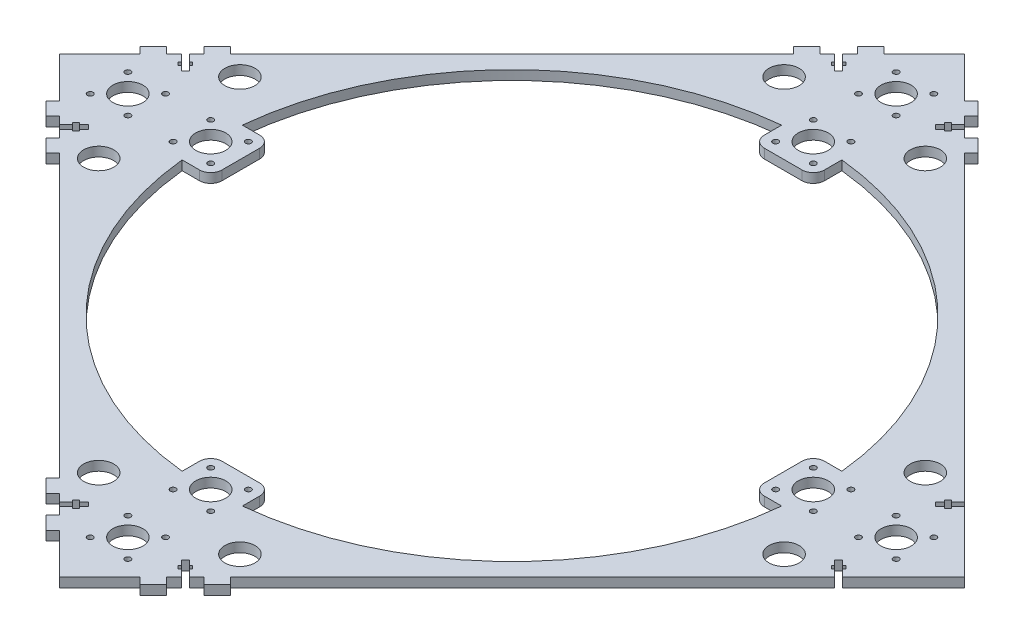
from build123d import *

# Parameters (mm, degrees)
SKETCH1_TOP_SKETCH_7_R   = 1.5
SKETCH1_TOP_SKETCH_7_R_2 = 8
BOSS_EXTRUDE2_DEPTH      = 5


with BuildPart() as part:
    # Sketch1-Top Sketch<7> → Boss-Extrude2 (new body)
    with BuildSketch(Plane(origin=(0, 0, 0), x_dir=(1, 0, 0), z_dir=(0, 1, 0))):
        Polygon((32.022907321, 215.464466094), (24.951839509, 222.535533906), (21.416305603, 219), (0, 240.416305603), (-21.416305603, 219), (-24.951839509, 222.535533906), (-32.022907321, 215.464466094), (-28.487373415, 211.928932188), (-32.39749263, 208.018812973), (-28.861958724, 204.483279068), (-27.978075248, 205.367162544), (-26.210308295, 203.599395591), (-27.094191771, 202.715512115), (-24.619318037, 200.24063838), (-26.74063838, 198.119318037), (-29.215512115, 200.594191771), (-30.099395591, 199.710308295), (-31.867162544, 201.478075248), (-30.983279068, 202.361958724), (-34.518812973, 205.89749263), (-38.428932188, 201.987373415), (-41.964466094, 205.522907321), (-49.035533906, 198.451839509), (-45.5, 194.916305603), (-194.916305603, 45.5), (-198.451839509, 49.035533906), (-205.522907321, 41.964466094), (-201.987373415, 38.428932188), (-205.89749263, 34.518812973), (-202.361958724, 30.983279068), (-201.478075248, 31.867162544), (-199.710308295, 30.099395591), (-200.594191771, 29.215512115), (-198.119318037, 26.74063838), (-200.24063838, 24.619318037), (-202.715512115, 27.094191771), (-203.599395591, 26.210308295), (-205.367162544, 27.978075248), (-204.483279068, 28.861958724), (-208.018812973, 32.39749263), (-211.928932188, 28.487373415), (-215.464466094, 32.022907321), (-222.535533906, 24.951839509), (-219, 21.416305603), (-240.416305603, 0), (-219, -21.416305603), (-222.535533906, -24.951839509), (-215.464466094, -32.022907321), (-211.928932188, -28.487373415), (-208.018812973, -32.39749263), (-204.483279068, -28.861958724), (-205.367162544, -27.978075248), (-203.599395591, -26.210308295), (-202.715512115, -27.094191771), (-200.24063838, -24.619318037), (-198.119318037, -26.74063838), (-200.594191771, -29.215512115), (-199.710308295, -30.099395591), (-201.478075248, -31.867162544), (-202.361958724, -30.983279068), (-205.89749263, -34.518812973), (-201.987373415, -38.428932188), (-205.522907321, -41.964466094), (-198.451839509, -49.035533906), (-194.916305603, -45.5), (-45.5, -194.916305603), (-49.035533906, -198.451839509), (-41.964466094, -205.522907321), (-38.428932188, -201.987373415), (-34.518812973, -205.89749263), (-30.983279068, -202.361958724), (-31.867162544, -201.478075248), (-30.099395591, -199.710308295), (-29.215512115, -200.594191771), (-26.74063838, -198.119318037), (-24.619318037, -200.24063838), (-27.094191771, -202.715512115), (-26.210308295, -203.599395591), (-27.978075248, -205.367162544), (-28.861958724, -204.483279068), (-32.39749263, -208.018812973), (-28.487373415, -211.928932188), (-32.022907321, -215.464466094), (-24.951839509, -222.535533906), (-21.416305603, -219), (0, -240.416305603), (21.416305603, -219), (24.951839509, -222.535533906), (32.022907321, -215.464466094), (28.487373415, -211.928932188), (32.39749263, -208.018812973), (28.861958724, -204.483279068), (27.978075248, -205.367162544), (26.210308295, -203.599395591), (27.094191771, -202.715512115), (24.619318037, -200.24063838), (26.74063838, -198.119318037), (29.215512115, -200.594191771), (30.099395591, -199.710308295), (31.867162544, -201.478075248), (30.983279068, -202.361958724), (34.518812973, -205.89749263), (38.428932188, -201.987373415), (41.964466094, -205.522907321), (49.035533906, -198.451839509), (45.5, -194.916305603), (205.89749263, -34.518812973), (202.361958724, -30.983279068), (201.478075248, -31.867162544), (199.710308295, -30.099395591), (200.594191771, -29.215512115), (198.119318037, -26.74063838), (200.24063838, -24.619318037), (202.715512115, -27.094191771), (203.599395591, -26.210308295), (205.367162544, -27.978075248), (204.483279068, -28.861958724), (208.018812973, -32.39749263), (240.416305603, 0), (208.018812973, 32.39749263), (204.483279068, 28.861958724), (205.367162544, 27.978075248), (203.599395591, 26.210308295), (202.715512115, 27.094191771), (200.24063838, 24.619318037), (198.119318037, 26.74063838), (200.594191771, 29.215512115), (199.710308295, 30.099395591), (201.478075248, 31.867162544), (202.361958724, 30.983279068), (205.89749263, 34.518812973), (45.5, 194.916305603), (49.035533906, 198.451839509), (41.964466094, 205.522907321), (38.428932188, 201.987373415), (34.518812973, 205.89749263), (30.983279068, 202.361958724), (31.867162544, 201.478075248), (30.099395591, 199.710308295), (29.215512115, 200.594191771), (26.74063838, 198.119318037), (24.619318037, 200.24063838), (27.094191771, 202.715512115), (26.210308295, 203.599395591), (27.978075248, 205.367162544), (28.861958724, 204.483279068), (32.39749263, 208.018812973), (28.487373415, 211.928932188), align=None)
        with Locations((10, 214)):
            Circle(SKETCH1_TOP_SKETCH_7_R, mode=Mode.SUBTRACT)
        with Locations((182, 37.5)):
            Circle(SKETCH1_TOP_SKETCH_7_R_2, mode=Mode.SUBTRACT)
        with BuildLine():
            ThreePointArc((16, 159.197989937), (113.13708499, 113.13708499), (159.197989937, 16))
            Line((159.197989937, 16), (150, 16))
            ThreePointArc((150, 16), (145.757359313, 14.242640687), (144, 10))
            Line((144, 10), (144, -10))
            ThreePointArc((144, -10), (145.757359313, -14.242640687), (150, -16))
            Line((150, -16), (159.197989937, -16))
            ThreePointArc((159.197989937, -16), (113.13708499, -113.13708499), (16, -159.197989937))
            Line((16, -159.197989937), (16, -150))
            ThreePointArc((16, -150), (14.242640687, -145.757359313), (10, -144))
            Line((10, -144), (-10, -144))
            ThreePointArc((-10, -144), (-14.242640687, -145.757359313), (-16, -150))
            Line((-16, -150), (-16, -159.197989937))
            ThreePointArc((-16, -159.197989937), (-113.13708499, -113.13708499), (-159.197989937, -16))
            Line((-159.197989937, -16), (-150, -16))
            ThreePointArc((-150, -16), (-145.757359313, -14.242640687), (-144, -10))
            Line((-144, -10), (-144, 10))
            ThreePointArc((-144, 10), (-145.757359313, 14.242640687), (-150, 16))
            Line((-150, 16), (-159.197989937, 16))
            ThreePointArc((-159.197989937, 16), (-113.13708499, 113.13708499), (-16, 159.197989937))
            Line((-16, 159.197989937), (-16, 150))
            ThreePointArc((-16, 150), (-14.242640687, 145.757359313), (-10, 144))
            Line((-10, 144), (10, 144))
            ThreePointArc((10, 144), (14.242640687, 145.757359313), (16, 150))
            Line((16, 150), (16, 159.197989937))
        make_face(mode=Mode.SUBTRACT)
        with Locations((182, -37.5)):
            Circle(SKETCH1_TOP_SKETCH_7_R_2, mode=Mode.SUBTRACT)
        with Locations((-10, -214)):
            Circle(SKETCH1_TOP_SKETCH_7_R, mode=Mode.SUBTRACT)
        with Locations((-10, -194)):
            Circle(SKETCH1_TOP_SKETCH_7_R, mode=Mode.SUBTRACT)
        with Locations((-37.5, -182)):
            Circle(SKETCH1_TOP_SKETCH_7_R_2, mode=Mode.SUBTRACT)
        with Locations((-10, -170)):
            Circle(SKETCH1_TOP_SKETCH_7_R, mode=Mode.SUBTRACT)
        with Locations((0, -160)):
            Circle(SKETCH1_TOP_SKETCH_7_R_2, mode=Mode.SUBTRACT)
        with Locations((-10, -150)):
            Circle(SKETCH1_TOP_SKETCH_7_R, mode=Mode.SUBTRACT)
        with Locations((-214, -10)):
            Circle(SKETCH1_TOP_SKETCH_7_R, mode=Mode.SUBTRACT)
        with Locations((-194, -10)):
            Circle(SKETCH1_TOP_SKETCH_7_R, mode=Mode.SUBTRACT)
        with Locations((-182, -37.5)):
            Circle(SKETCH1_TOP_SKETCH_7_R_2, mode=Mode.SUBTRACT)
        with Locations((-170, -10)):
            Circle(SKETCH1_TOP_SKETCH_7_R, mode=Mode.SUBTRACT)
        with Locations((-150, -10)):
            Circle(SKETCH1_TOP_SKETCH_7_R, mode=Mode.SUBTRACT)
        with Locations((10, -214)):
            Circle(SKETCH1_TOP_SKETCH_7_R, mode=Mode.SUBTRACT)
        with Locations((0, -204)):
            Circle(SKETCH1_TOP_SKETCH_7_R_2, mode=Mode.SUBTRACT)
        with Locations((10, -194)):
            Circle(SKETCH1_TOP_SKETCH_7_R, mode=Mode.SUBTRACT)
        with Locations((10, -170)):
            Circle(SKETCH1_TOP_SKETCH_7_R, mode=Mode.SUBTRACT)
        with Locations((37.5, -182)):
            Circle(SKETCH1_TOP_SKETCH_7_R_2, mode=Mode.SUBTRACT)
        with Locations((10, -150)):
            Circle(SKETCH1_TOP_SKETCH_7_R, mode=Mode.SUBTRACT)
        with Locations((-204, 0)):
            Circle(SKETCH1_TOP_SKETCH_7_R_2, mode=Mode.SUBTRACT)
        with Locations((-214, 10)):
            Circle(SKETCH1_TOP_SKETCH_7_R, mode=Mode.SUBTRACT)
        with Locations((-194, 10)):
            Circle(SKETCH1_TOP_SKETCH_7_R, mode=Mode.SUBTRACT)
        with Locations((-160, 0)):
            Circle(SKETCH1_TOP_SKETCH_7_R_2, mode=Mode.SUBTRACT)
        with Locations((-170, 10)):
            Circle(SKETCH1_TOP_SKETCH_7_R, mode=Mode.SUBTRACT)
        with Locations((-150, 10)):
            Circle(SKETCH1_TOP_SKETCH_7_R, mode=Mode.SUBTRACT)
        with Locations((-182, 37.5)):
            Circle(SKETCH1_TOP_SKETCH_7_R_2, mode=Mode.SUBTRACT)
        with Locations((-10, 150)):
            Circle(SKETCH1_TOP_SKETCH_7_R, mode=Mode.SUBTRACT)
        with Locations((-37.5, 182)):
            Circle(SKETCH1_TOP_SKETCH_7_R_2, mode=Mode.SUBTRACT)
        with Locations((-10, 170)):
            Circle(SKETCH1_TOP_SKETCH_7_R, mode=Mode.SUBTRACT)
        with Locations((-10, 194)):
            Circle(SKETCH1_TOP_SKETCH_7_R, mode=Mode.SUBTRACT)
        with Locations((-10, 214)):
            Circle(SKETCH1_TOP_SKETCH_7_R, mode=Mode.SUBTRACT)
        with Locations((10, 150)):
            Circle(SKETCH1_TOP_SKETCH_7_R, mode=Mode.SUBTRACT)
        with Locations((0, 160)):
            Circle(SKETCH1_TOP_SKETCH_7_R_2, mode=Mode.SUBTRACT)
        with Locations((10, 170)):
            Circle(SKETCH1_TOP_SKETCH_7_R, mode=Mode.SUBTRACT)
        with Locations((37.5, 182)):
            Circle(SKETCH1_TOP_SKETCH_7_R_2, mode=Mode.SUBTRACT)
        with Locations((10, 194)):
            Circle(SKETCH1_TOP_SKETCH_7_R, mode=Mode.SUBTRACT)
        with Locations((0, 204)):
            Circle(SKETCH1_TOP_SKETCH_7_R_2, mode=Mode.SUBTRACT)
        with Locations((214, 10)):
            Circle(SKETCH1_TOP_SKETCH_7_R, mode=Mode.SUBTRACT)
        with Locations((170, -10)):
            Circle(SKETCH1_TOP_SKETCH_7_R, mode=Mode.SUBTRACT)
        with Locations((194, -10)):
            Circle(SKETCH1_TOP_SKETCH_7_R, mode=Mode.SUBTRACT)
        with Locations((214, -10)):
            Circle(SKETCH1_TOP_SKETCH_7_R, mode=Mode.SUBTRACT)
        with Locations((170, 10)):
            Circle(SKETCH1_TOP_SKETCH_7_R, mode=Mode.SUBTRACT)
        with Locations((194, 10)):
            Circle(SKETCH1_TOP_SKETCH_7_R, mode=Mode.SUBTRACT)
        with Locations((150, -10)):
            Circle(SKETCH1_TOP_SKETCH_7_R, mode=Mode.SUBTRACT)
        with Locations((150, 10)):
            Circle(SKETCH1_TOP_SKETCH_7_R, mode=Mode.SUBTRACT)
        with Locations((160, 0)):
            Circle(SKETCH1_TOP_SKETCH_7_R_2, mode=Mode.SUBTRACT)
        with Locations((204, 0)):
            Circle(SKETCH1_TOP_SKETCH_7_R_2, mode=Mode.SUBTRACT)
    extrude(amount=BOSS_EXTRUDE2_DEPTH)


solid = part.part
